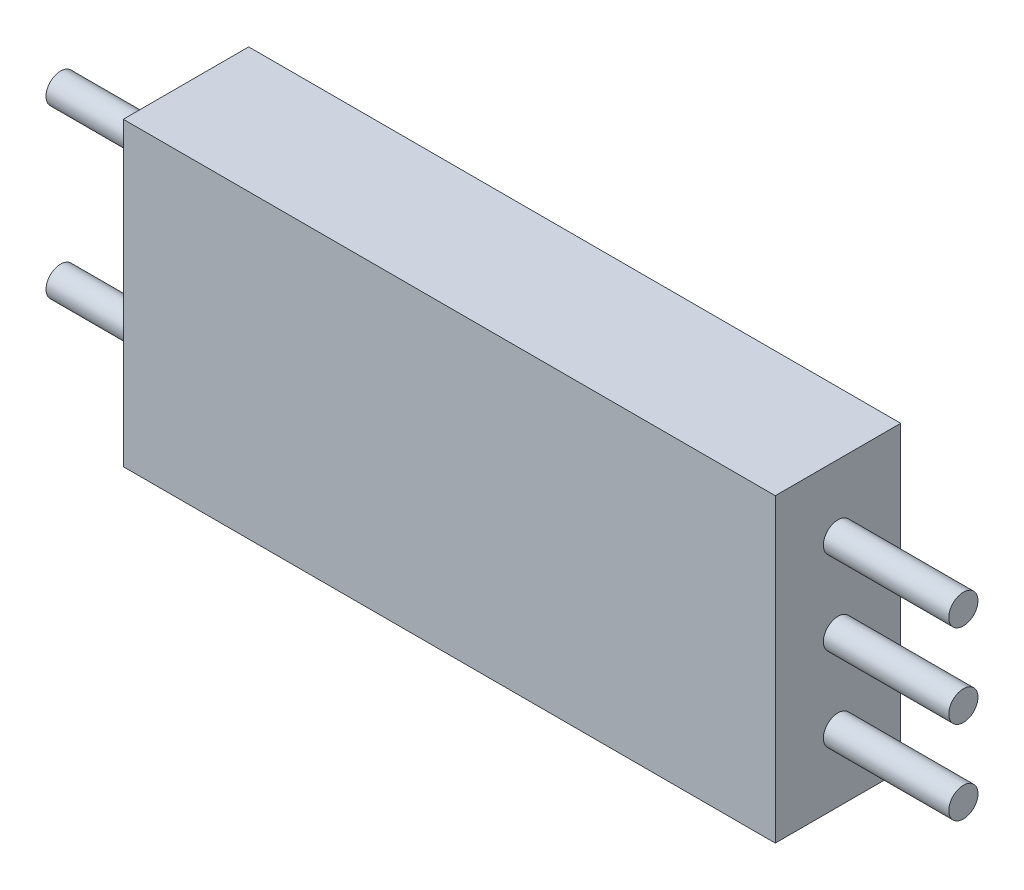
from build123d import *

# Parameters (mm, degrees)
SKETCH_2_W      = 78
SKETCH_2_H      = 36
EXTRUDE_1_DEPTH = 7.5
SKETCH_3_R      = 1.75
EXTRUDE_2_DEPTH = 15
EXTRUDE_START   = 15
SKETCH_4_R      = 1.75
EXTRUDE_3_DEPTH = 15


with BuildPart() as part:
    # Эскиз2 → Бобышка-Вытянуть1 (new, symmetric)
    with BuildSketch(Plane.XY):
        Rectangle(SKETCH_2_W, SKETCH_2_H)
    extrude(amount=EXTRUDE_1_DEPTH, both=True)

    # Эскиз3 → Бобышка-Вытянуть2 (add)
    with BuildSketch(Plane(origin=(39, 0, 0), x_dir=(0, 0, -1), z_dir=(1, 0, 0))):
        with Locations(Location((0, -10, 0), (0, 0, 180))):
            Circle(SKETCH_3_R)
        with Locations(Location((0, 0, 0), (0, 0, 180))):
            Circle(SKETCH_3_R)
        with Locations(Location((0, 10, 0), (0, 0, 180))):
            Circle(SKETCH_3_R)
    extrude(amount=EXTRUDE_2_DEPTH)

    # Эскиз4 → Бобышка-Вытянуть3 (add)
    with BuildSketch(Plane.ZY.offset(39).offset(EXTRUDE_START)):
        with Locations((0, 10)):
            Circle(SKETCH_4_R)
        with Locations((0, -10)):
            Circle(SKETCH_4_R)
    extrude(amount=-EXTRUDE_3_DEPTH)


solid = part.part
